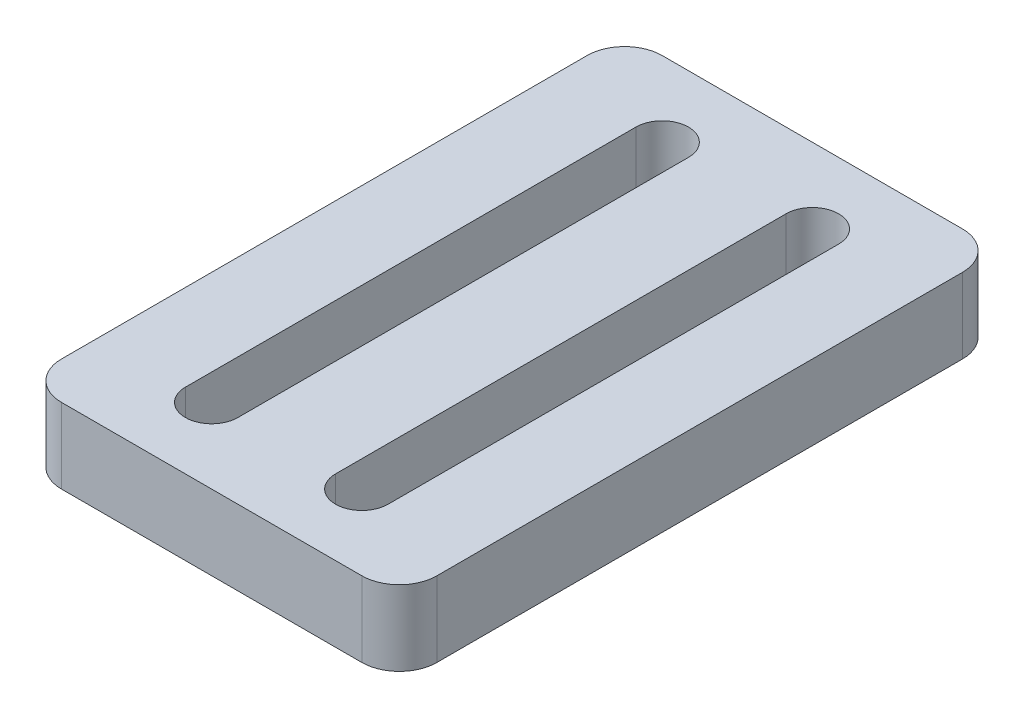
from build123d import *

# Parameters (mm, degrees)
SKETCH1_W           = 25
SKETCH1_H           = 40
BOSS_EXTRUDE1_DEPTH = 5
CUT_EXTRUDE1_DEPTH  = 5
FILLET1_R           = 2.5


with BuildPart() as part:
    # Sketch1 → Boss-Extrude1 (new body)
    with BuildSketch(Plane(origin=(0, 0, 0), x_dir=(1, 0, 0), z_dir=(0, 1, 0))):
        Rectangle(SKETCH1_W, SKETCH1_H)
    extrude(amount=BOSS_EXTRUDE1_DEPTH)

    # Sketch2 → Cut-Extrude1 (cut)
    with BuildSketch(Plane(origin=(0, 5, 0), x_dir=(1, 0, 0), z_dir=(0, 1, 0))):
        with BuildLine():
            Line((-3.25, 15), (-3.25, -15))
            ThreePointArc((-3.25, -15), (-5, -16.75), (-6.75, -15))
            Line((-6.75, -15), (-6.75, 15))
            ThreePointArc((-6.75, 15), (-5, 16.75), (-3.25, 15))
        make_face()
        with BuildLine():
            Line((3.25, 15), (3.25, -15))
            ThreePointArc((3.25, -15), (5, -16.75), (6.75, -15))
            Line((6.75, -15), (6.75, 15))
            ThreePointArc((6.75, 15), (5, 16.75), (3.25, 15))
        make_face()
    extrude(amount=-CUT_EXTRUDE1_DEPTH, mode=Mode.SUBTRACT)

    # Fillet1
    fillet1_edges = [part.edges().sort_by_distance(p)[0] for p in [
        (12.5, 2.5, 20),
        (-12.5, 2.5, 20),
        (-12.5, 2.5, -20),
        (12.5, 2.5, -20),
    ]]
    fillet(fillet1_edges, radius=FILLET1_R)


solid = part.part
